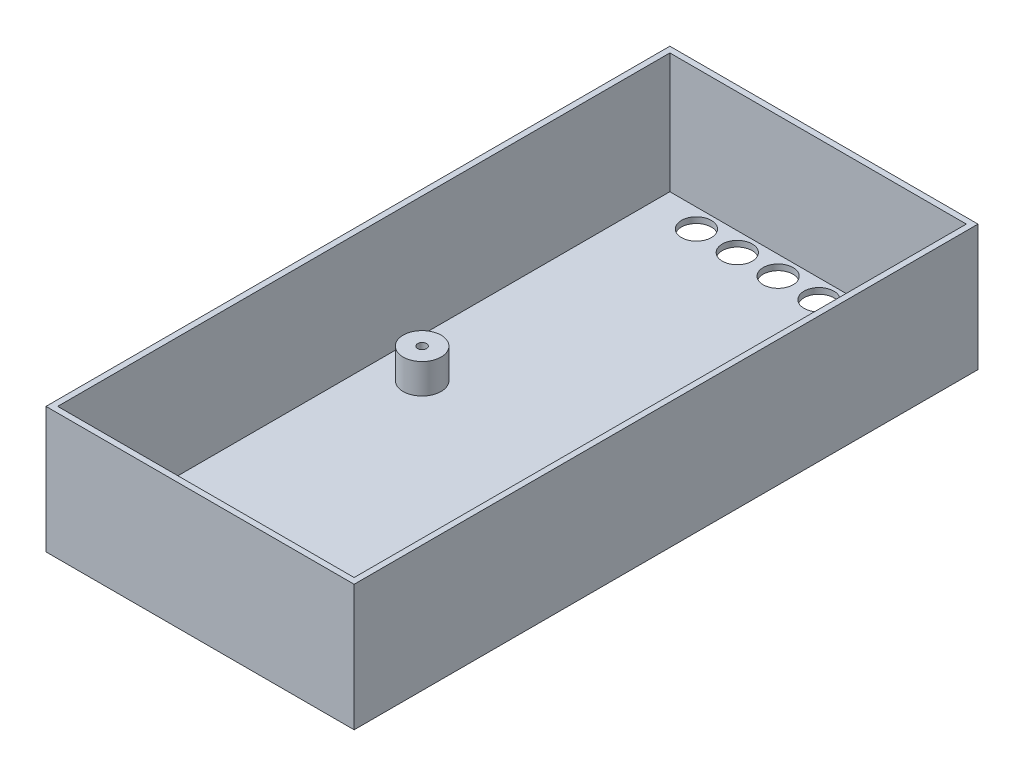
from build123d import *

# Parameters (mm, degrees)
SKETCH1_W            = 64.516
SKETCH1_H            = 133.223
SKETCH1_R            = 3.25
SKETCH1_R_2          = 0.9652
SKETCH1_W_2          = 13.208
SKETCH1_H_2          = 13.208
FRONT_FACE_DEPTH     = 1.27
SKETCH2_R            = 4.1275
SKETCH2_R_2          = 0.9652
SKETCH2_R_3          = 4.064
SCREW_POST_PCB_DEPTH = 6.5
SKETCH5_W            = 1.27
SKETCH5_H            = 27.432
SIDE_WALLS_DEPTH     = 133.223
SKETCH6_W            = 1.27
SKETCH6_H            = 27.432
BOTTOM_WALL_DEPTH    = 67.056
SKETCH8_W            = 67.056
SKETCH8_H            = 27.432
TOP_WALL_DEPTH       = 1.27


with BuildPart() as part:
    # Sketch1 → front_face (new body)
    with BuildSketch(Plane(origin=(0, 0, 0), x_dir=(1, 0, 0), z_dir=(0, 1, 0))):
        with Locations((51.562, 6.096)):
            Rectangle(SKETCH1_W, SKETCH1_H)
        with Locations(Location((29.21, 68.58, 0), (0, 0, 270))):
            Circle(SKETCH1_R, mode=Mode.SUBTRACT)
        with Locations(Location((38.1, 68.58, 0), (0, 0, 270))):
            Circle(SKETCH1_R, mode=Mode.SUBTRACT)
        with Locations(Location((46.99, 68.58, 0), (0, 0, 270))):
            Circle(SKETCH1_R, mode=Mode.SUBTRACT)
        with Locations(Location((55.88, 68.58, 0), (0, 0, 270))):
            Circle(SKETCH1_R, mode=Mode.SUBTRACT)
        with Locations(Location((73.66, 68.58, 0), (0, 0, 270))):
            Circle(SKETCH1_R_2, mode=Mode.SUBTRACT)
        with Locations(Location((73.66, 10.16, 0), (0, 0, 270))):
            Circle(SKETCH1_R_2, mode=Mode.SUBTRACT)
        with Locations(Location((27.94, 10.16, 0), (0, 0, 270))):
            Circle(SKETCH1_R_2, mode=Mode.SUBTRACT)
        with Locations((71.12, 52.07)):
            Rectangle(SKETCH1_W_2, SKETCH1_H_2, mode=Mode.SUBTRACT)
    extrude(amount=FRONT_FACE_DEPTH)

    # Sketch2 → screw_post_PCB (add)
    # profile 1 of 3: a face of its own
    with BuildSketch(Plane(origin=(0, 1.27, 0), x_dir=(1, 0, 0), z_dir=(0, 1, 0))):
        with Locations(Location((27.94, 10.16, 0), (0, 0, 90))):
            Circle(SKETCH2_R)
        with Locations(Location((27.94, 10.16, 0), (0, 0, 270))):
            Circle(SKETCH2_R_2, mode=Mode.SUBTRACT)
    # profile 2 of 3: a face of its own
    with BuildSketch(Plane(origin=(0, 1.27, 0), x_dir=(1, 0, 0), z_dir=(0, 1, 0))):
        with Locations(Location((73.66, 10.16, 0), (0, 0, 90))):
            Circle(SKETCH2_R)
        with Locations(Location((73.66, 10.16, 0), (0, 0, 270))):
            Circle(SKETCH2_R_2, mode=Mode.SUBTRACT)
    # profile 3 of 3: a face of its own
    with BuildSketch(Plane(origin=(0, 1.27, 0), x_dir=(1, 0, 0), z_dir=(0, 1, 0))):
        with Locations(Location((73.66, 68.58, 0), (0, 0, 90))):
            Circle(SKETCH2_R_3)
        with Locations(Location((73.66, 68.58, 0), (0, 0, 270))):
            Circle(SKETCH2_R_2, mode=Mode.SUBTRACT)
    extrude(amount=SCREW_POST_PCB_DEPTH)

    # Sketch5 → side_walls (add)
    with BuildSketch(Plane(origin=(0, 0, -72.7075), x_dir=(-1, 0, 0), z_dir=(0, 0, -1))):
        with Locations((-84.455, 13.716)):
            Rectangle(SKETCH5_W, SKETCH5_H)
        with Locations((-18.669, 13.716)):
            Rectangle(SKETCH5_W, SKETCH5_H)
    extrude(amount=-SIDE_WALLS_DEPTH)

    # Sketch6 → bottom_wall (add)
    with BuildSketch(Plane(origin=(85.09, 0, 0), x_dir=(0, 0, -1), z_dir=(1, 0, 0))):
        with Locations((-61.1505, 13.716)):
            Rectangle(SKETCH6_W, SKETCH6_H)
    extrude(amount=-BOTTOM_WALL_DEPTH)

    # Sketch8 → top_wall (add)
    with BuildSketch(Plane(origin=(0, 0, -72.7075), x_dir=(-1, 0, 0), z_dir=(0, 0, -1))):
        with Locations((-51.562, 13.716)):
            Rectangle(SKETCH8_W, SKETCH8_H)
    extrude(amount=TOP_WALL_DEPTH)


solid = part.part
